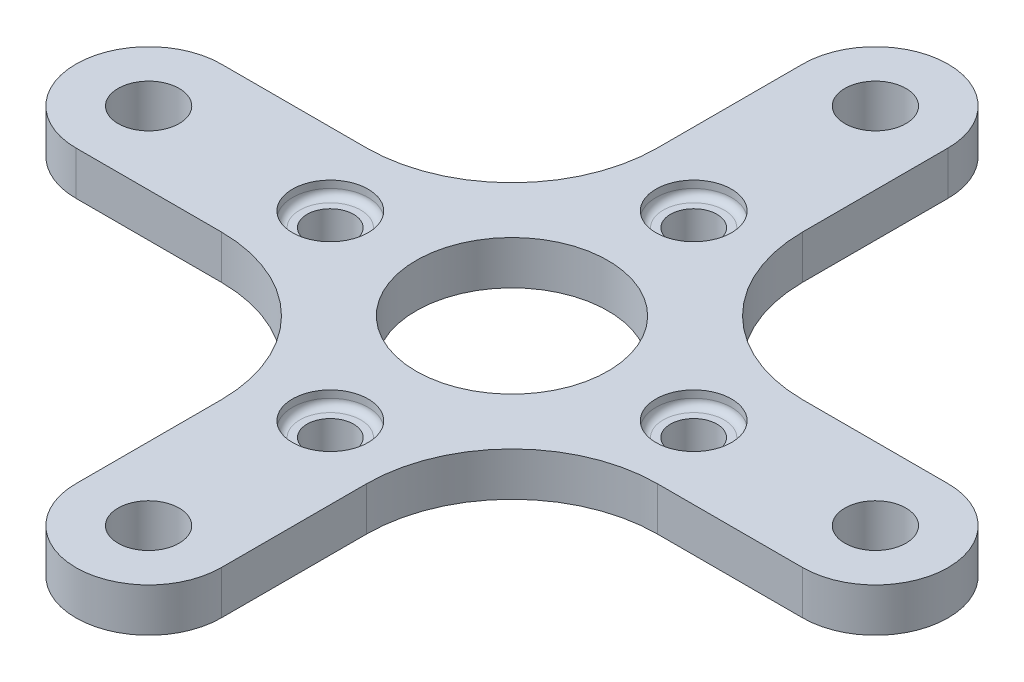
from build123d import *

# Parameters (mm, degrees)
SKETCH1_R           = 2.1
SKETCH1_R_2         = 1.6
SKETCH1_R_3         = 6.6
BOSS_EXTRUDE1_DEPTH = 3
CUT_EXTRUDE1_START  = -1
SKETCH2_R           = 2.6
SKETCH2_R_2         = 1.6
CUT_EXTRUDE1_DEPTH  = 1
FILLET1_R           = 0.5


with BuildPart() as part:
    # Sketch1 → Boss-Extrude1 (new body)
    with BuildSketch(Plane(origin=(0, 0, 0), x_dir=(1, 0, 0), z_dir=(0, 1, 0))):
        with BuildLine():
            ThreePointArc((-25, -5), (-30, 0), (-25, 5))
            Line((-25, 5), (-15, 5))
            ThreePointArc((-15, 5), (-7.928932188, 7.928932188), (-5, 15))
            Line((-5, 15), (-5, 25))
            ThreePointArc((-5, 25), (0, 30), (5, 25))
            Line((5, 25), (5, 15))
            ThreePointArc((5, 15), (7.928932188, 7.928932188), (15, 5))
            Line((15, 5), (25, 5))
            ThreePointArc((25, 5), (30, 0), (25, -5))
            Line((25, -5), (15, -5))
            ThreePointArc((15, -5), (7.928932188, -7.928932188), (5, -15))
            Line((5, -15), (5, -25))
            ThreePointArc((5, -25), (0, -30), (-5, -25))
            Line((-5, -25), (-5, -15))
            ThreePointArc((-5, -15), (-7.928932188, -7.928932188), (-15, -5))
            Line((-15, -5), (-25, -5))
        make_face()
        with Locations(Location((-25, 0, 0), (0, 0, 270))):
            Circle(SKETCH1_R, mode=Mode.SUBTRACT)
        with Locations(Location((0, -25, 0), (0, 0, 270))):
            Circle(SKETCH1_R, mode=Mode.SUBTRACT)
        with Locations(Location((25, 0, 0), (0, 0, 270))):
            Circle(SKETCH1_R, mode=Mode.SUBTRACT)
        with Locations(Location((0, 25, 0), (0, 0, 270))):
            Circle(SKETCH1_R, mode=Mode.SUBTRACT)
        with Locations(Location((-12.5, 0, 0), (0, 0, 270))):
            Circle(SKETCH1_R_2, mode=Mode.SUBTRACT)
        with Locations(Location((0, -12.5, 0), (0, 0, 270))):
            Circle(SKETCH1_R_2, mode=Mode.SUBTRACT)
        with Locations(Location((12.5, 0, 0), (0, 0, 270))):
            Circle(SKETCH1_R_2, mode=Mode.SUBTRACT)
        with Locations(Location((0, 12.5, 0), (0, 0, 270))):
            Circle(SKETCH1_R_2, mode=Mode.SUBTRACT)
        with Locations(Location((0, 0, 0), (0, 0, 270))):
            Circle(SKETCH1_R_3, mode=Mode.SUBTRACT)
    extrude(amount=BOSS_EXTRUDE1_DEPTH)

    # Sketch2 → Cut-Extrude1 (cut)
    # profile 1 of 4: a face of its own
    with BuildSketch(Plane(origin=(0, 3, 0), x_dir=(1, 0, 0), z_dir=(0, 1, 0)).offset(CUT_EXTRUDE1_START)):
        with Locations(Location((0, 12.5, 0), (0, 0, 270))):
            Circle(SKETCH2_R)
        with Locations(Location((0, 12.5, 0), (0, 0, 270))):
            Circle(SKETCH2_R_2, mode=Mode.SUBTRACT)
    # profile 2 of 4: a face of its own
    with BuildSketch(Plane(origin=(0, 3, 0), x_dir=(1, 0, 0), z_dir=(0, 1, 0)).offset(CUT_EXTRUDE1_START)):
        with Locations(Location((12.5, 0, 0), (0, 0, 270))):
            Circle(SKETCH2_R)
        with Locations(Location((12.5, 0, 0), (0, 0, 270))):
            Circle(SKETCH2_R_2, mode=Mode.SUBTRACT)
    # profile 3 of 4: a face of its own
    with BuildSketch(Plane(origin=(0, 3, 0), x_dir=(1, 0, 0), z_dir=(0, 1, 0)).offset(CUT_EXTRUDE1_START)):
        with Locations(Location((0, -12.5, 0), (0, 0, 270))):
            Circle(SKETCH2_R)
        with Locations(Location((0, -12.5, 0), (0, 0, 270))):
            Circle(SKETCH2_R_2, mode=Mode.SUBTRACT)
    # profile 4 of 4: a face of its own
    with BuildSketch(Plane(origin=(0, 3, 0), x_dir=(1, 0, 0), z_dir=(0, 1, 0)).offset(CUT_EXTRUDE1_START)):
        with Locations(Location((-12.5, 0, 0), (0, 0, 270))):
            Circle(SKETCH2_R)
        with Locations(Location((-12.5, 0, 0), (0, 0, 270))):
            Circle(SKETCH2_R_2, mode=Mode.SUBTRACT)
    extrude(amount=CUT_EXTRUDE1_DEPTH, mode=Mode.SUBTRACT)

    # Fillet1
    fillet1_edges = [part.edges().sort_by_distance(p)[0] for p in [
        (0, 2, -15.1),
        (12.5, 2, -2.6),
        (0, 2, 9.9),
        (-12.5, 2, -2.6),
    ]]
    fillet(fillet1_edges, radius=FILLET1_R)


solid = part.part
